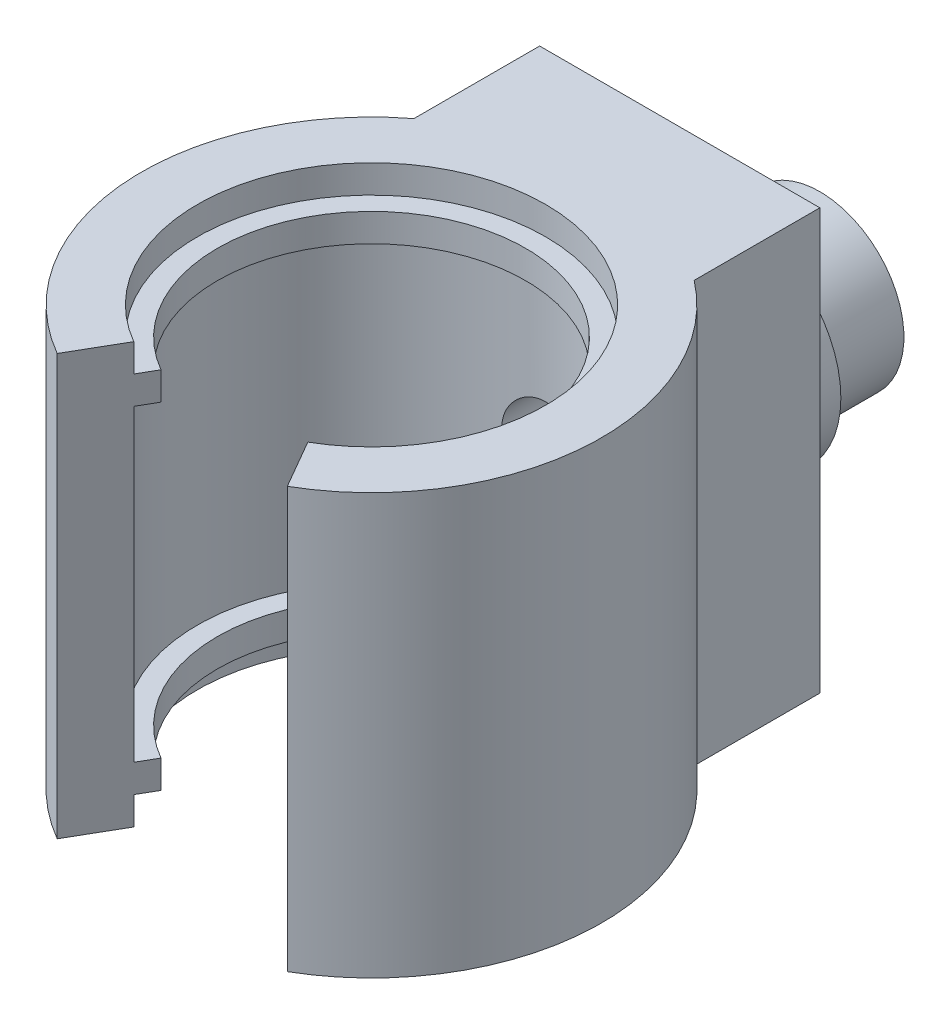
from build123d import *

# Parameters (mm, degrees)
SKETCH1_R               = 6.211279156
BOSS_EXTRUDE1_DEPTH     = 15
CUT_EXTRUDE1_DEPTH      = 21.332857777
CUT_EXTRUDE1_DEPTH_BACK = 21.332857777
BOSS_EXTRUDE3_DEPTH     = 1
SKETCH6_R               = 1.4
CUT_EXTRUDE2_DEPTH      = 10
SKETCH7_R               = 3.75
BOSS_EXTRUDE4_DEPTH     = 2
SKETCH8_R               = 3
BOSS_EXTRUDE5_DEPTH     = 3
CUT_EXTRUDE3_DEPTH      = 29.749810043
CUT_EXTRUDE3_DEPTH_BACK = 29.749810043
SKETCH9_R               = 1.4


with BuildPart() as part:
    # Sketch1 → Boss-Extrude1 (new body)
    with BuildSketch(Plane(origin=(0, 0, 0), x_dir=(1, 0, 0), z_dir=(0, 1, 0))):
        with BuildLine():
            Line((-5, 6.513455717), (-5, 11))
            Line((-5, 11), (5, 11))
            Line((5, 11), (5, 6.513455717))
            ThreePointArc((5, 6.513455717), (0, -8.211279156), (-5, 6.513455717))
        make_face()
        with Locations(Location((0, 0, 0), (0, 0, 270))):
            Circle(SKETCH1_R, mode=Mode.SUBTRACT)
    extrude(amount=BOSS_EXTRUDE1_DEPTH)

    # Sketch4 → Cut-Extrude1 (cut, two sides: drawn at the far end of the back side and taken through both)
    with BuildSketch(Plane(origin=(0, 15, 0), x_dir=(1, 0, 0), z_dir=(0, 1, 0)).offset(-CUT_EXTRUDE1_DEPTH_BACK)):
        with BuildLine():
            Line((-3.105639578, -5.379125539), (-4.105639578, -7.111176346))
            ThreePointArc((-4.105639578, -7.111176346), (0, -8.211279156), (4.105639578, -7.111176346))
            Line((4.105639578, -7.111176346), (3.105639578, -5.379125539))
            ThreePointArc((3.105639578, -5.379125539), (0, -6.211279156), (-3.105639578, -5.379125539))
        make_face()
    extrude(amount=CUT_EXTRUDE1_DEPTH + CUT_EXTRUDE1_DEPTH_BACK, mode=Mode.SUBTRACT)

    # Sketch5 → Boss-Extrude3 (add)
    with BuildSketch(Plane(origin=(0, 1, 0), x_dir=(-1, 0, 0), z_dir=(0, -1, 0))):
        with BuildLine():
            Line((3.105639578, -5.379125539), (2.749999992, -4.763139708))
            ThreePointArc((2.749999992, -4.763139708), (0, 5.499999985), (-2.749999992, -4.763139708))
            Line((-2.749999992, -4.763139708), (-3.105639578, -5.379125539))
            ThreePointArc((-3.105639578, -5.379125539), (0, 6.211279156), (3.105639578, -5.379125539))
        make_face()
    boss_extrude3 = extrude(amount=-BOSS_EXTRUDE3_DEPTH)

    # Mirror1: Boss-Extrude3 across plane
    add(boss_extrude3.mirror(Plane.ZX.offset(7.5)))

    # Sketch6 → Cut-Extrude2 (cut)
    with BuildSketch(Plane(origin=(0, 0, -11), x_dir=(-1, 0, 0), z_dir=(0, 0, -1))):
        with Locations((0, 7.5)):
            Circle(SKETCH6_R)
    extrude(amount=-CUT_EXTRUDE2_DEPTH, mode=Mode.SUBTRACT)

    # Sketch7 → Boss-Extrude4 (add)
    with BuildSketch(Plane(origin=(0, 0, -11), x_dir=(-1, 0, 0), z_dir=(0, 0, -1))):
        with Locations((0, 7.5)):
            Circle(SKETCH7_R)
    extrude(amount=BOSS_EXTRUDE4_DEPTH)

    # Sketch8 → Boss-Extrude5 (add)
    with BuildSketch(Plane(origin=(0, 0, -13), x_dir=(-1, 0, 0), z_dir=(0, 0, -1))):
        with Locations((0, 7.5)):
            Circle(SKETCH8_R)
    extrude(amount=BOSS_EXTRUDE5_DEPTH)

    # Sketch9 → Cut-Extrude3 (cut, two sides: drawn at the far end of the back side and taken through both)
    with BuildSketch(Plane(origin=(0, 0, -16), x_dir=(-1, 0, 0), z_dir=(0, 0, -1)).offset(-CUT_EXTRUDE3_DEPTH_BACK)):
        with Locations((0, 7.5)):
            Circle(SKETCH9_R)
    extrude(amount=CUT_EXTRUDE3_DEPTH + CUT_EXTRUDE3_DEPTH_BACK, mode=Mode.SUBTRACT)


solid = part.part
